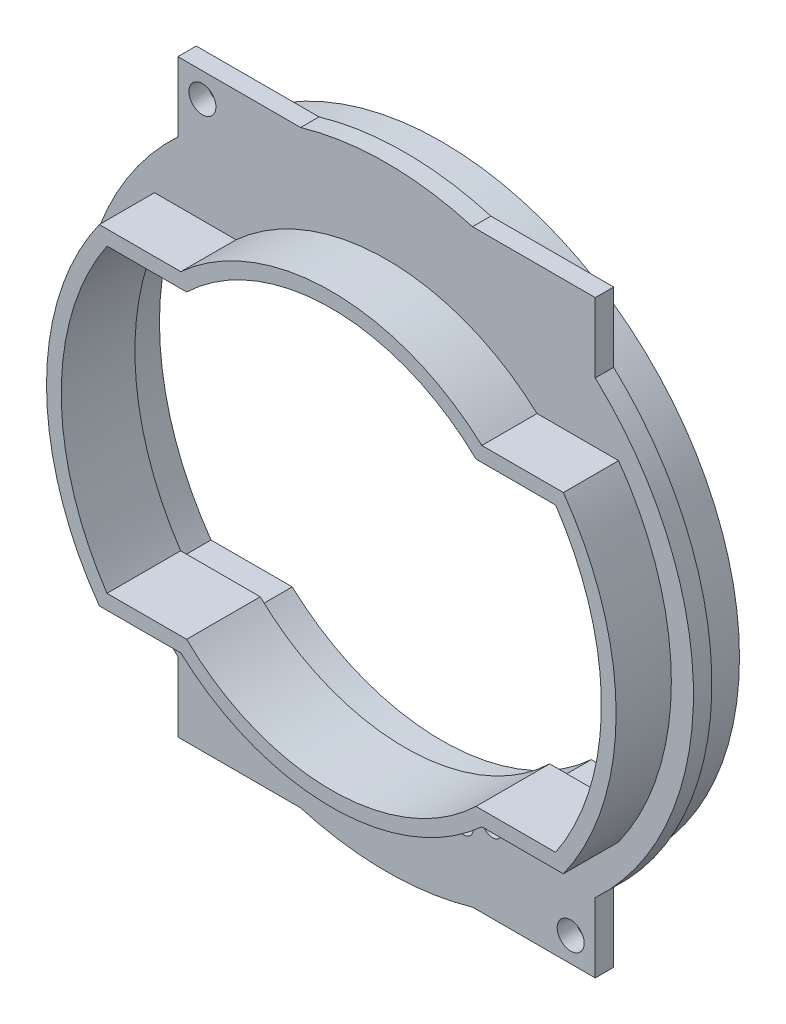
from build123d import *

# Parameters (mm, degrees)
EXTRUDE_1_DEPTH     = 1.5
EXTRUDE_2_DEPTH     = 4.5
SKETCH_5_R          = 24.25
EXTRUDE_4_DEPTH     = 3
EXTRUDE_5_DEPTH     = 1.5
SKETCH_7_R          = 0.5
CUT_EXTRUDE_2_DEPTH = 37.482872694
SKETCH_8_R          = 0.8
CUT_EXTRUDE_3_DEPTH = 4
SKETCH_9_R          = 1.1
CUT_EXTRUDE_4_DEPTH = 10


with BuildPart() as part:
    # 草图1 → 凸台-拉伸1 (new body)
    with BuildSketch(Plane.XY):
        with BuildLine():
            ThreePointArc((-18.273956879, 12.25), (0, 22), (18.273956879, 12.25))
            ThreePointArc((18.273956879, 12.25), (21.047886489, 6.402067973), (22, 0))
            Line((22, 0), (25, 0))
            ThreePointArc((25, 0), (0, 25), (-25, 0))
            Line((-25, 0), (-22, 0))
            ThreePointArc((-22, 0), (-21.047886489, 6.402067973), (-18.273956879, 12.25))
        make_face()
        with BuildLine():
            Line((25, 0), (22, 0))
            ThreePointArc((22, 0), (21.047886489, -6.402067973), (18.273956879, -12.25))
            ThreePointArc((18.273956879, -12.25), (0, -22), (-18.273956879, -12.25))
            ThreePointArc((-18.273956879, -12.25), (-21.047886489, -6.402067973), (-22, 0))
            Line((-22, 0), (-25, 0))
            ThreePointArc((-25, 0), (0, -25), (25, 0))
        make_face()
        with BuildLine():
            ThreePointArc((-18.273956879, -12.25), (0, -22), (18.273956879, -12.25))
            Line((18.273956879, -12.25), (11.787175234, -12.25))
            ThreePointArc((11.787175234, -12.25), (0, -17), (-11.787175234, -12.25))
            Line((-11.787175234, -12.25), (-18.273956879, -12.25))
        make_face()
        with BuildLine():
            Line((11.787175234, 12.25), (18.273956879, 12.25))
            ThreePointArc((18.273956879, 12.25), (0, 22), (-18.273956879, 12.25))
            Line((-18.273956879, 12.25), (-11.787175234, 12.25))
            ThreePointArc((-11.787175234, 12.25), (0, 17), (11.787175234, 12.25))
        make_face()
    extrude(amount=EXTRUDE_1_DEPTH)

    # 草图2 → 凸台-拉伸2 (add)
    with BuildSketch(Plane.XY.offset(1.5)):
        with BuildLine():
            Line((-18.903372715, 13.45), (-12.261219352, 13.45))
            ThreePointArc((-12.261219352, 13.45), (0, 18.2), (12.261219352, 13.45))
            Line((12.261219352, 13.45), (18.903372715, 13.45))
            ThreePointArc((18.903372715, 13.45), (23.2, 0), (18.903372715, -13.45))
            Line((18.903372715, -13.45), (12.261219352, -13.45))
            ThreePointArc((12.261219352, -13.45), (0, -18.2), (-12.261219352, -13.45))
            Line((-12.261219352, -13.45), (-18.903372715, -13.45))
            ThreePointArc((-18.903372715, -13.45), (-23.2, 0), (-18.903372715, 13.45))
        make_face()
        with BuildLine():
            Line((-18.273956879, 12.25), (-11.787175234, 12.25))
            ThreePointArc((-11.787175234, 12.25), (0, 17), (11.787175234, 12.25))
            Line((11.787175234, 12.25), (18.273956879, 12.25))
            ThreePointArc((18.273956879, 12.25), (22, 0), (18.273956879, -12.25))
            Line((18.273956879, -12.25), (11.787175234, -12.25))
            ThreePointArc((11.787175234, -12.25), (0, -17), (-11.787175234, -12.25))
            Line((-11.787175234, -12.25), (-18.273956879, -12.25))
            ThreePointArc((-18.273956879, -12.25), (-22, 0), (-18.273956879, 12.25))
        make_face(mode=Mode.SUBTRACT)
    extrude(amount=EXTRUDE_2_DEPTH)

    # 草图5 → 凸台-拉伸4 (add)
    with BuildSketch(Plane(origin=(0, 0, 0), x_dir=(-1, 0, 0), z_dir=(0, 0, -1))):
        Circle(SKETCH_5_R)
        with BuildLine():
            Line((-18.799933511, -13.25), (-12.183492931, -13.25))
            ThreePointArc((-12.183492931, -13.25), (0, -18), (12.183492931, -13.25))
            Line((12.183492931, -13.25), (18.799933511, -13.25))
            ThreePointArc((18.799933511, -13.25), (23, 0), (18.799933511, 13.25))
            Line((18.799933511, 13.25), (12.183492931, 13.25))
            ThreePointArc((12.183492931, 13.25), (0, 18), (-12.183492931, 13.25))
            Line((-12.183492931, 13.25), (-18.799933511, 13.25))
            ThreePointArc((-18.799933511, 13.25), (-23, 0), (-18.799933511, -13.25))
        make_face(mode=Mode.SUBTRACT)
    extrude(amount=EXTRUDE_4_DEPTH)

    # 草图6 → 凸台-拉伸5 (add)
    with BuildSketch(Plane.XY):
        with BuildLine():
            Line((-17, 24), (-17, 16.941074346))
            ThreePointArc((-17, 16.941074346), (-9.203646443, 22.16512784), (0, 24))
            Line((0, 24), (-17, 24))
        make_face()
        with BuildLine():
            ThreePointArc((0, 24), (9.203646443, 22.16512784), (17, 16.941074346))
            Line((17, 16.941074346), (17, 24))
            Line((17, 24), (0, 24))
        make_face()
        with BuildLine():
            ThreePointArc((17, -16.941074346), (9.203646443, -22.16512784), (0, -24))
            Line((0, -24), (17, -24))
            Line((17, -24), (17, -16.941074346))
        make_face()
        with BuildLine():
            Line((-17, -16.941074346), (-17, -24))
            Line((-17, -24), (0, -24))
            ThreePointArc((0, -24), (-9.203646443, -22.16512784), (-17, -16.941074346))
        make_face()
    extrude(amount=EXTRUDE_5_DEPTH)

    # 草图7 → 切除-拉伸2 (cut, through all)
    with BuildSketch(Plane(origin=(0, 0, -3), x_dir=(-1, 0, 0), z_dir=(0, 0, -1))):
        with Locations((-12.857243394, -14.660876246)):
            Circle(SKETCH_7_R)
        with Locations((-10.833619544, -16.21365744)):
            Circle(SKETCH_7_R)
        with Locations((-8.624629459, -17.48901846)):
            Circle(SKETCH_7_R)
        with Locations((-6.268069573, -18.465137525)):
            Circle(SKETCH_7_R)
        with Locations((-3.804261279, -19.125312968)):
            Circle(SKETCH_7_R)
        with Locations((-1.27536102, -19.458249003)):
            Circle(SKETCH_7_R)
        with Locations((1.27536102, -19.458249003)):
            Circle(SKETCH_7_R)
        with Locations((3.804261279, -19.125312968)):
            Circle(SKETCH_7_R)
        with Locations((6.268069573, -18.465137525)):
            Circle(SKETCH_7_R)
        with Locations((8.624629459, -17.48901846)):
            Circle(SKETCH_7_R)
    extrude(amount=-CUT_EXTRUDE_2_DEPTH, mode=Mode.SUBTRACT)

    # 草图8 → 切除-拉伸3 (cut)
    with BuildSketch(Plane.XY.offset(1.5)):
        with Locations((12.857243394, -14.660876246)):
            Circle(SKETCH_8_R)
        with Locations((10.833619544, -16.21365744)):
            Circle(SKETCH_8_R)
        with Locations((8.624629459, -17.48901846)):
            Circle(SKETCH_8_R)
        with Locations((6.268069573, -18.465137525)):
            Circle(SKETCH_8_R)
        with Locations((3.804261279, -19.125312968)):
            Circle(SKETCH_8_R)
        with Locations((1.27536102, -19.458249003)):
            Circle(SKETCH_8_R)
        with Locations((-1.27536102, -19.458249003)):
            Circle(SKETCH_8_R)
        with Locations((-3.804261279, -19.125312968)):
            Circle(SKETCH_8_R)
        with Locations((-6.268069573, -18.465137525)):
            Circle(SKETCH_8_R)
        with Locations((-8.624629459, -17.48901846)):
            Circle(SKETCH_8_R)
    extrude(amount=-CUT_EXTRUDE_3_DEPTH, mode=Mode.SUBTRACT)

    # 草图9 → 切除-拉伸4 (cut)
    with BuildSketch(Plane.XY.offset(1.5)):
        with Locations((-15, 22)):
            Circle(SKETCH_9_R)
        with Locations((15, -22)):
            Circle(SKETCH_9_R)
    extrude(amount=-CUT_EXTRUDE_4_DEPTH, mode=Mode.SUBTRACT)


solid = part.part
